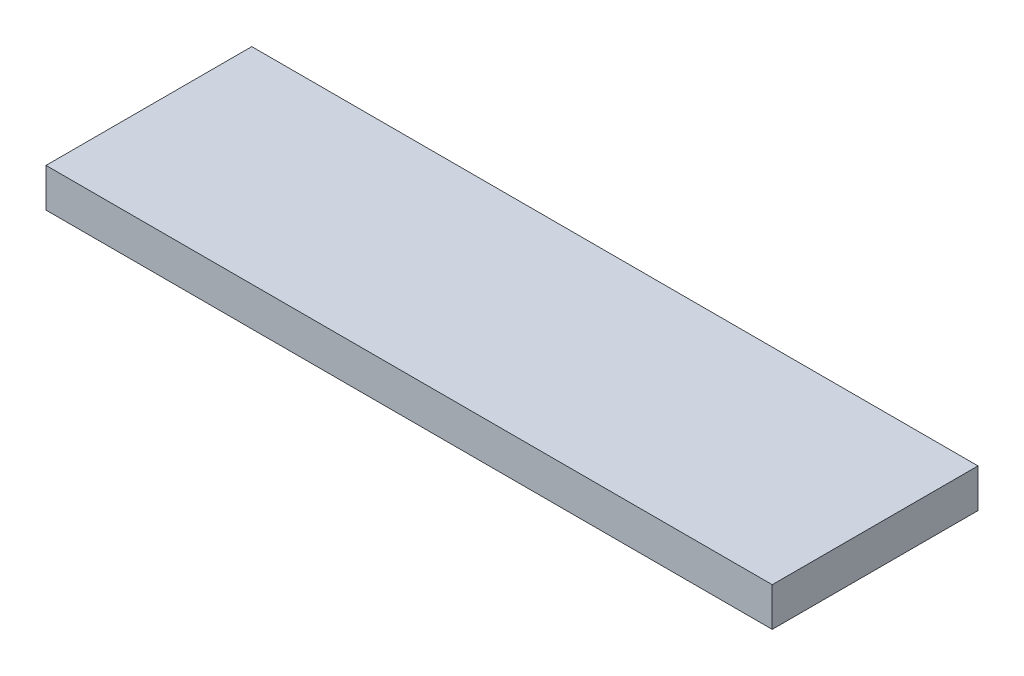
from build123d import *

# Parameters (mm, degrees)
SKETCH1_W           = 30
SKETCH1_H           = 8.5
BOSS_EXTRUDE1_DEPTH = 1.6


with BuildPart() as part:
    # Sketch1 → Boss-Extrude1 (new body)
    with BuildSketch(Plane(origin=(0, 0, 0), x_dir=(1, 0, 0), z_dir=(0, 1, 0))):
        with Locations((15, 4.25)):
            Rectangle(SKETCH1_W, SKETCH1_H)
    extrude(amount=BOSS_EXTRUDE1_DEPTH)


solid = part.part
